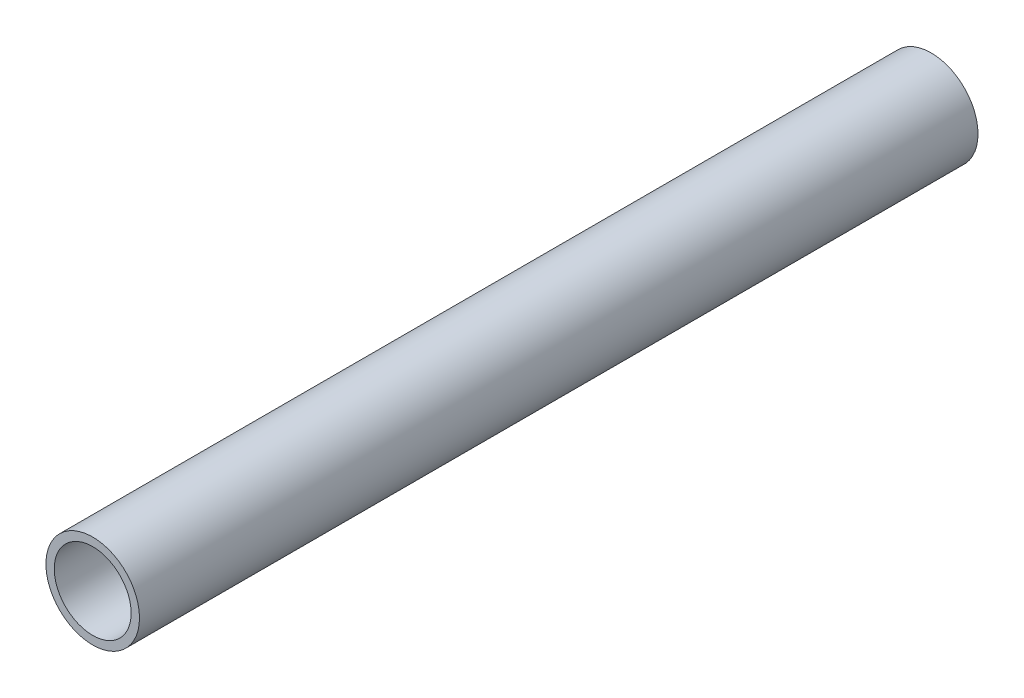
from build123d import *

# Parameters (mm, degrees)
SKETCH_1_R      = 16.85
SKETCH_1_R_2    = 13.85
EXTRUDE_1_DEPTH = 151


with BuildPart() as part:
    # Эскиз1 → Бобышка-Вытянуть1 (new, symmetric)
    with BuildSketch(Plane.XY):
        Circle(SKETCH_1_R)
        Circle(SKETCH_1_R_2, mode=Mode.SUBTRACT)
    extrude(amount=EXTRUDE_1_DEPTH, both=True)


solid = part.part
